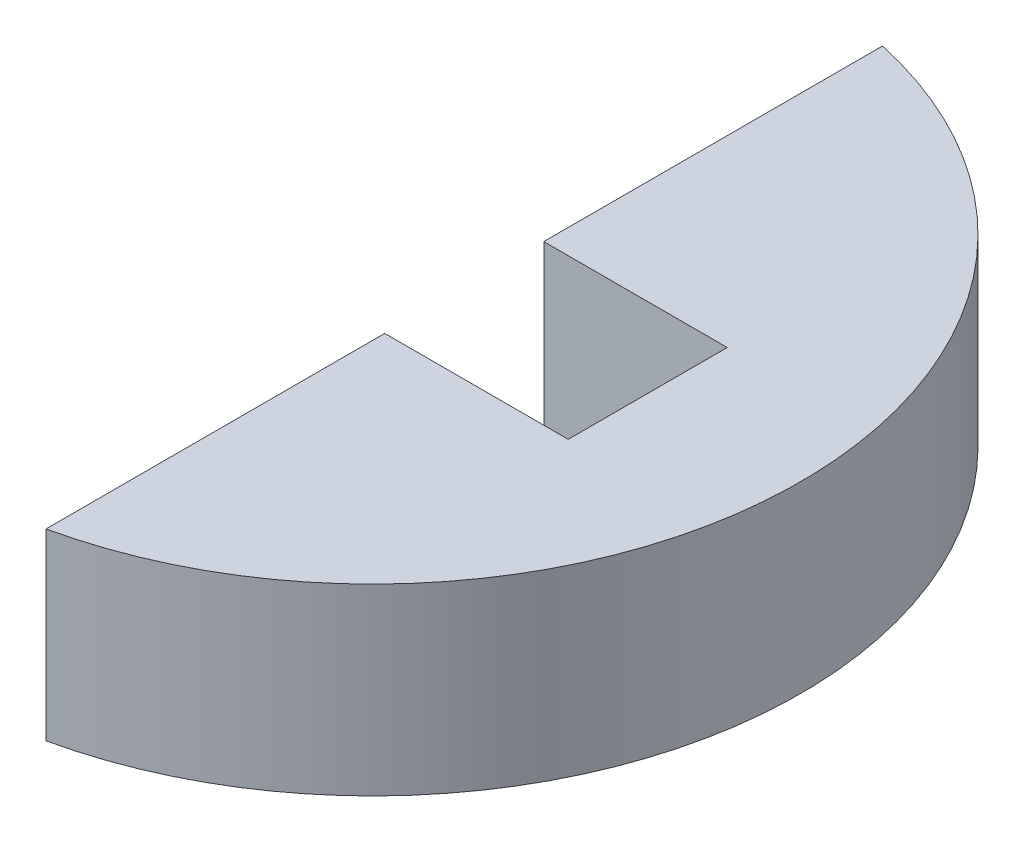
from build123d import *

# Parameters (mm, degrees)
BOSS_EXTRUDE1_DEPTH      = 1.5
BOSS_EXTRUDE1_DEPTH_BACK = 1.5


with BuildPart() as part:
    # Sketch1 → Boss-Extrude1 (new, two sides: drawn at the far end of the back side and taken through both)
    with BuildSketch(Plane(origin=(0, 0, 0), x_dir=(1, 0, 0), z_dir=(0, 1, 0)).offset(-BOSS_EXTRUDE1_DEPTH_BACK)):
        with BuildLine():
            Line((1.5, -6.837397166), (1.5, -1.3))
            Line((1.5, -1.3), (4.5, -1.3))
            Line((4.5, -1.3), (4.5, 1.3))
            Line((4.5, 1.3), (1.5, 1.3))
            Line((1.5, 1.3), (1.5, 6.837397166))
            ThreePointArc((1.5, 6.837397166), (7, 0), (1.5, -6.837397166))
        make_face()
    extrude(amount=BOSS_EXTRUDE1_DEPTH + BOSS_EXTRUDE1_DEPTH_BACK)


solid = part.part
